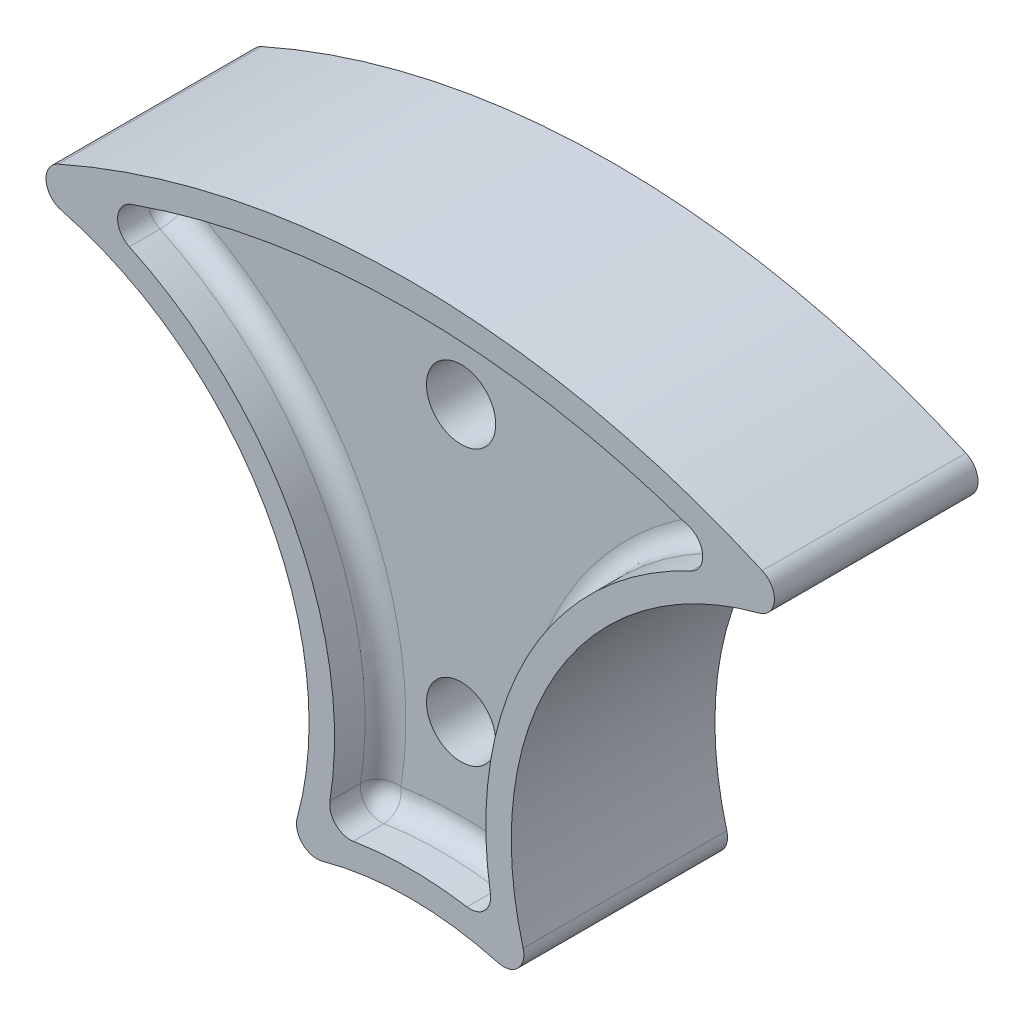
from build123d import *

# Parameters (mm, degrees)
BOSS_EXTRUDE1_DEPTH             = 20
FILLET1_R                       = 2
RECESS_DEPTH                    = 5
RECESS_FILLET_R                 = 2
M8X1_25_TAPPED_HOLE2_AT_2_COUNT = 2
M8X1_25_TAPPED_HOLE2_AT_2_PITCH = 27


with BuildPart() as part:
    # Sketch1 → Boss-Extrude1 (new body)
    with BuildSketch(Plane.XY):
        with BuildLine():
            ThreePointArc((40.270970206, 74.854852606), (0, 85), (-40.270970206, 74.854852606))
            ThreePointArc((-40.270970206, 74.854852606), (-14.837398118, 59.604782697), (-12.374368671, 30.0520382))
            ThreePointArc((-12.374368671, 30.0520382), (0, 32.5), (12.374368671, 30.0520382))
            ThreePointArc((12.374368671, 30.0520382), (14.837398118, 59.604782697), (40.270970206, 74.854852606))
        make_face()
    extrude(amount=BOSS_EXTRUDE1_DEPTH)

    # Fillet1
    fillet1_edges = [part.edges().sort_by_distance(p)[0] for p in [
        (-12.374368671, 30.0520382, 10),
        (-40.270970206, 74.854852606, 10),
        (40.270970206, 74.854852606, 10),
        (12.374368671, 30.0520382, 10),
    ]]
    fillet(fillet1_edges, radius=FILLET1_R)

    # Sketch6 → Recess (cut)
    with BuildSketch(Plane.XY.offset(20)):
        with BuildLine():
            ThreePointArc((32.278956857, 75.923112056), (0, 82.5), (-32.278956857, 75.923112056))
            ThreePointArc((-32.278956857, 75.923112056), (-11.986412015, 59.700859487), (-8.465654652, 33.96075222))
            ThreePointArc((-8.465654652, 33.96075222), (0, 35), (8.465654652, 33.96075222))
            ThreePointArc((8.465654652, 33.96075222), (11.986412015, 59.700859487), (32.278956857, 75.923112056))
        make_face()
    extrude(amount=-RECESS_DEPTH, mode=Mode.SUBTRACT)

    # Recess Fillet
    recess_fillet_edges = [part.edges().sort_by_distance(p)[0] for p in [
        (11.986412015, 59.700859487, 15),
        (32.278956857, 75.923112056, 17.5),
        (0, 35, 15),
        (8.465654652, 33.96075222, 17.5),
        (-11.986412015, 59.700859487, 15),
        (-8.465654652, 33.96075222, 17.5),
        (0, 82.5, 15),
        (-32.278956857, 75.923112056, 17.5),
    ]]
    fillet(recess_fillet_edges, radius=RECESS_FILLET_R)

    # Sketch5 → M8x1.25 Tapped Hole2 (revolve, cut)
    with BuildSketch(Plane(origin=(0, 45, 20), x_dir=(0, -1, 0), z_dir=(1, 0, 0))):
        Polygon((0, 0), (0, 20), (4.5, 20), (3.4, 18.9), (3.4, 1.1), (4.5, 0), align=None)
    m8x1_25_tapped_hole2 = revolve(axis=Axis((0, 45, 26.35), (0, 0, -1)), mode=Mode.SUBTRACT)

    # M8x1.25 Tapped Hole2 at 2: M8x1.25 Tapped Hole2 ×2
    with Locations(*[(0, i * M8X1_25_TAPPED_HOLE2_AT_2_PITCH, 0) for i in range(1, M8X1_25_TAPPED_HOLE2_AT_2_COUNT)]):
        add(m8x1_25_tapped_hole2, mode=Mode.SUBTRACT)


solid = part.part
